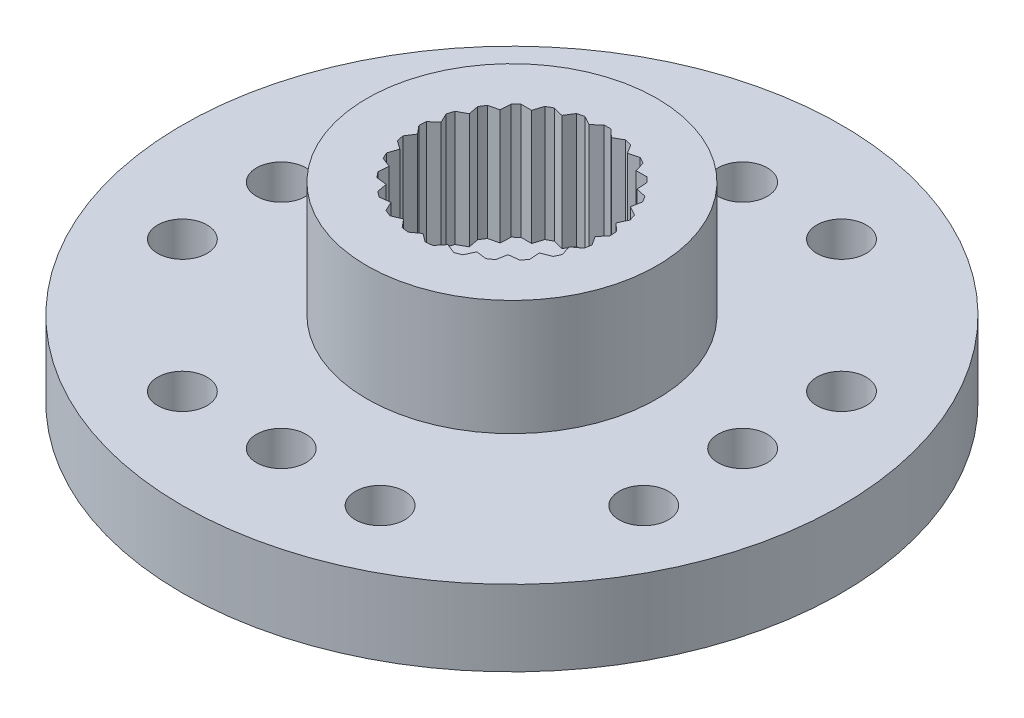
from build123d import *

# Parameters (mm, degrees)
SKETCH2_R           = 6
SKETCH2_R_2         = 1.5
BOSS_EXTRUDE1_DEPTH = 1.15
SKETCH3_R           = 4.4
BOSS_EXTRUDE2_DEPTH = 3.5
SKETCH5_R           = 10
SKETCH5_R_2         = 0.75
SKETCH5_R_3         = 1.5
BOSS_EXTRUDE4_DEPTH = 1.15


with BuildPart() as part:
    # Sketch2 → Boss-Extrude1 (new, symmetric)
    with BuildSketch(Plane(origin=(0, 0, 0), x_dir=(1, 0, 0), z_dir=(0, 1, 0))):
        with Locations(Location((0, 0, 0), (0, 0, 270))):
            Circle(SKETCH2_R)
        with Locations(Location((0, 0, 0), (0, 0, 270))):
            Circle(SKETCH2_R_2, mode=Mode.SUBTRACT)
    extrude(amount=BOSS_EXTRUDE1_DEPTH, both=True)

    # Sketch3 → Boss-Extrude2 (add)
    with BuildSketch(Plane(origin=(0, 1.15, 0), x_dir=(1, 0, 0), z_dir=(0, 1, 0))):
        with Locations(Location((0, 0, 0), (0, 0, 270))):
            Circle(SKETCH3_R)
        with BuildLine():
            Line((0.107421435, 2.898009771), (0.338399731, 2.678709694))
            Line((0.338399731, 2.678709694), (0.61665913, 2.83367809))
            ThreePointArc((0.61665913, 2.83367809), (0.721200673, 2.808891167), (0.824752316, 2.780248841))
            Line((0.824752316, 2.780248841), (0.993936292, 2.510396512))
            Line((0.993936292, 2.510396512), (1.301992734, 2.591295993))
            ThreePointArc((1.301992734, 2.591295993), (1.397085655, 2.541289372), (1.490260976, 2.48779465))
            Line((1.490260976, 2.48779465), (1.587020181, 2.184345885))
            Line((1.587020181, 2.184345885), (1.905517346, 2.186093238))
            ThreePointArc((1.905517346, 2.186093238), (1.985186607, 2.11400902), (2.062131058, 2.039023173))
            Line((2.062131058, 2.039023173), (2.080385755, 1.721044772))
            Line((2.080385755, 1.721044772), (2.389311295, 1.643530205))
            ThreePointArc((2.389311295, 1.643530205), (2.448550984, 1.553897705), (2.504429862, 1.46213237))
            Line((2.504429862, 1.46213237), (2.443033042, 1.149604087))
            Line((2.443033042, 1.149604087), (2.722976028, 0.997698125))
            ThreePointArc((2.722976028, 0.997698125), (2.758063897, 0.896149284), (2.789366126, 0.793370413))
            Line((2.789366126, 0.793370413), (2.652175577, 0.505929549))
            Line((2.652175577, 0.505929549), (2.885546163, 0.289177003))
            ThreePointArc((2.885546163, 0.289177003), (2.894277512, 0.182092507), (2.899036259, 0.074758075))
            Line((2.899036259, 0.074758075), (2.694672167, -0.169534403))
            Line((2.694672167, -0.169534403), (2.866806821, -0.437514174))
            ThreePointArc((2.866806821, -0.437514174), (2.848633027, -0.543405812), (2.826549281, -0.648551587))
            Line((2.826549281, -0.648551587), (2.567852594, -0.834345885))
            Line((2.567852594, -0.834345885), (2.667935462, -1.136714727))
            ThreePointArc((2.667935462, -1.136714727), (2.623998452, -1.234759946), (2.576459817, -1.331110368))
            Line((2.576459817, -1.331110368), (2.279685399, -1.446732346))
            Line((2.279685399, -1.446732346), (2.301427906, -1.764491312))
            ThreePointArc((2.301427906, -1.764491312), (2.234488404, -1.84852957), (2.164481907, -1.930030589))
            Line((2.164481907, -1.930030589), (1.848277186, -1.968215294))
            Line((1.848277186, -1.968215294), (1.790313171, -2.281398419))
            ThreePointArc((1.790313171, -2.281398419), (1.704577232, -2.346149284), (1.616501638, -2.40767989))
            Line((1.616501638, -2.40767989), (1.30073492, -2.366028036))
            Line((1.30073492, -2.366028036), (1.166706475, -2.654956874))
            ThreePointArc((1.166706475, -2.654956874), (1.067561203, -2.696351809), (0.966950626, -2.734045809))
            Line((0.966950626, -2.734045809), (0.671462695, -2.615174535))
            Line((0.671462695, -2.615174535), (0.469791321, -2.861694623))
            ThreePointArc((0.469791321, -2.861694623), (0.363466377, -2.877132634), (0.25664255, -2.888621575))
            Line((0.25664255, -2.888621575), (0, -2.7))
            Line((0, -2.7), (-0.25664255, -2.888621575))
            ThreePointArc((-0.25664255, -2.888621575), (-0.363466377, -2.877132634), (-0.469791321, -2.861694623))
            Line((-0.469791321, -2.861694623), (-0.671462695, -2.615174535))
            Line((-0.671462695, -2.615174535), (-0.966950626, -2.734045809))
            ThreePointArc((-0.966950626, -2.734045809), (-1.067561203, -2.696351809), (-1.166706475, -2.654956874))
            Line((-1.166706475, -2.654956874), (-1.30073492, -2.366028036))
            Line((-1.30073492, -2.366028036), (-1.616501638, -2.40767989))
            ThreePointArc((-1.616501638, -2.40767989), (-1.704577232, -2.346149284), (-1.790313171, -2.281398419))
            Line((-1.790313171, -2.281398419), (-1.848277186, -1.968215294))
            Line((-1.848277186, -1.968215294), (-2.164481907, -1.930030589))
            ThreePointArc((-2.164481907, -1.930030589), (-2.234488404, -1.84852957), (-2.301427906, -1.764491312))
            Line((-2.301427906, -1.764491312), (-2.279685399, -1.446732346))
            Line((-2.279685399, -1.446732346), (-2.576459817, -1.331110368))
            ThreePointArc((-2.576459817, -1.331110368), (-2.623998452, -1.234759946), (-2.667935462, -1.136714727))
            Line((-2.667935462, -1.136714727), (-2.567852594, -0.834345885))
            Line((-2.567852594, -0.834345885), (-2.826549281, -0.648551587))
            ThreePointArc((-2.826549281, -0.648551587), (-2.848633027, -0.543405812), (-2.866806821, -0.437514174))
            Line((-2.866806821, -0.437514174), (-2.694672167, -0.169534403))
            Line((-2.694672167, -0.169534403), (-2.899036259, 0.074758075))
            ThreePointArc((-2.899036259, 0.074758075), (-2.894277512, 0.182092507), (-2.885546163, 0.289177003))
            Line((-2.885546163, 0.289177003), (-2.652175577, 0.505929549))
            Line((-2.652175577, 0.505929549), (-2.789366126, 0.793370413))
            ThreePointArc((-2.789366126, 0.793370413), (-2.758063897, 0.896149284), (-2.722976028, 0.997698125))
            Line((-2.722976028, 0.997698125), (-2.443033042, 1.149604087))
            Line((-2.443033042, 1.149604087), (-2.504429862, 1.46213237))
            ThreePointArc((-2.504429862, 1.46213237), (-2.448550984, 1.553897705), (-2.389311295, 1.643530205))
            Line((-2.389311295, 1.643530205), (-2.080385755, 1.721044772))
            Line((-2.080385755, 1.721044772), (-2.062131058, 2.039023173))
            ThreePointArc((-2.062131058, 2.039023173), (-1.985186607, 2.11400902), (-1.905517346, 2.186093238))
            Line((-1.905517346, 2.186093238), (-1.587020181, 2.184345885))
            Line((-1.587020181, 2.184345885), (-1.490260976, 2.48779465))
            ThreePointArc((-1.490260976, 2.48779465), (-1.397085655, 2.541289372), (-1.301992734, 2.591295993))
            Line((-1.301992734, 2.591295993), (-0.993936292, 2.510396512))
            Line((-0.993936292, 2.510396512), (-0.824752316, 2.780248841))
            ThreePointArc((-0.824752316, 2.780248841), (-0.721200673, 2.808891167), (-0.61665913, 2.83367809))
            Line((-0.61665913, 2.83367809), (-0.338399731, 2.678709694))
            Line((-0.338399731, 2.678709694), (-0.107421435, 2.898009771))
            ThreePointArc((-0.107421435, 2.898009771), (0, 2.9), (0.107421435, 2.898009771))
        make_face(mode=Mode.SUBTRACT)
    extrude(amount=BOSS_EXTRUDE2_DEPTH)

    # Sketch5 → Boss-Extrude4 (add, symmetric)
    with BuildSketch(Plane(origin=(0, 0, 0), x_dir=(1, 0, 0), z_dir=(0, 1, 0))):
        with Locations(Location((0, 0, 0), (0, 0, 270))):
            Circle(SKETCH5_R)
        with Locations(Location((0, 7, 0), (0, 0, 270))):
            Circle(SKETCH5_R_2, mode=Mode.SUBTRACT)
        with Locations(Location((-3, 7, 0), (0, 0, 270))):
            Circle(SKETCH5_R_2, mode=Mode.SUBTRACT)
        with Locations(Location((3, 7, 0), (0, 0, 270))):
            Circle(SKETCH5_R_2, mode=Mode.SUBTRACT)
        with Locations(Location((7, 3, 0), (0, 0, 270))):
            Circle(SKETCH5_R_2, mode=Mode.SUBTRACT)
        with Locations(Location((7, 0, 0), (0, 0, 270))):
            Circle(SKETCH5_R_2, mode=Mode.SUBTRACT)
        with Locations(Location((7, -3, 0), (0, 0, 270))):
            Circle(SKETCH5_R_2, mode=Mode.SUBTRACT)
        with Locations(Location((3, -7, 0), (0, 0, 270))):
            Circle(SKETCH5_R_2, mode=Mode.SUBTRACT)
        with Locations(Location((0, -7, 0), (0, 0, 270))):
            Circle(SKETCH5_R_2, mode=Mode.SUBTRACT)
        with Locations(Location((-3, -7, 0), (0, 0, 270))):
            Circle(SKETCH5_R_2, mode=Mode.SUBTRACT)
        with Locations(Location((-7, -3, 0), (0, 0, 270))):
            Circle(SKETCH5_R_2, mode=Mode.SUBTRACT)
        with Locations(Location((-7, 0, 0), (0, 0, 270))):
            Circle(SKETCH5_R_2, mode=Mode.SUBTRACT)
        with Locations(Location((-7, 3, 0), (0, 0, 270))):
            Circle(SKETCH5_R_2, mode=Mode.SUBTRACT)
        with Locations(Location((0, 0, 0), (0, 0, 270))):
            Circle(SKETCH5_R_3, mode=Mode.SUBTRACT)
    extrude(amount=BOSS_EXTRUDE4_DEPTH, both=True)


solid = part.part
